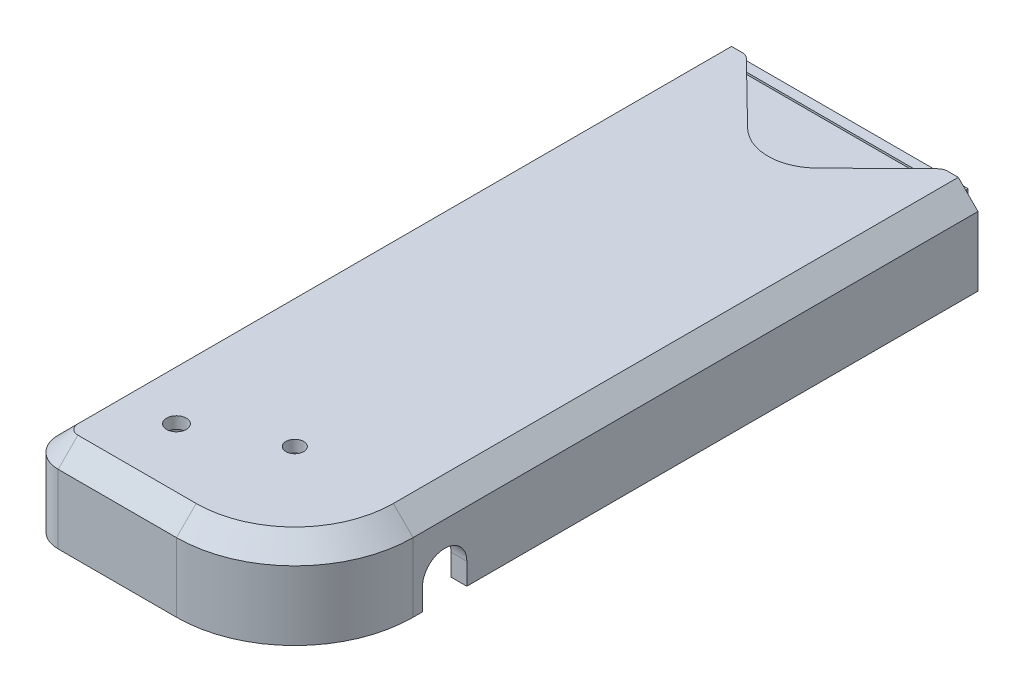
from build123d import *

# Parameters (mm, degrees)
EXTRUDE_1_DEPTH     = 9
SKETCH_2_W          = 12.1
SKETCH_2_H          = 5
CUT_EXTRUDE_1_DEPTH = 0.9
SKETCH_3_R          = 29.401854515
SKETCH_3_W          = 23
SKETCH_3_H          = 15
CUT_EXTRUDE_2_DEPTH = 1
CHAMFER_1_SIZE      = 2
CUT_EXTRUDE_4_DEPTH = 7.8
SKETCH_5_W          = 12.1
SKETCH_5_H          = 1.6
CUT_EXTRUDE_5_DEPTH = 5
SKETCH_6_R          = 1
SKETCH_6_R_2        = 0.9
CUT_EXTRUDE_6_DEPTH = 3
CUT_EXTRUDE_7_DEPTH = 3
EXTRUDE_2_DEPTH     = 3
CUT_EXTRUDE_9_DEPTH = 1.7
FILLET_1_R          = 1


with BuildPart() as part:
    # Эскиз1 → Бобышка-Вытянуть1 (new body)
    with BuildSketch(Plane(origin=(0, 0, 0), x_dir=(1, 0, 0), z_dir=(0, 1, 0))):
        with BuildLine():
            Line((-13.5, 35.6), (13.5, 35.6))
            Line((13.5, 35.6), (13.5, -23.6))
            ThreePointArc((13.5, -23.6), (9.985281374, -32.085281374), (1.5, -35.6))
            Line((1.5, -35.6), (-10.5, -35.6))
            ThreePointArc((-10.5, -35.6), (-12.621320344, -34.721320344), (-13.5, -32.6))
            Line((-13.5, -32.6), (-13.5, 35.6))
        make_face()
    extrude(amount=EXTRUDE_1_DEPTH)

    # Эскиз2 → Вырез-Вытянуть1 (cut)
    with BuildSketch(Plane(origin=(0, 0, -35.6), x_dir=(-1, 0, 0), z_dir=(0, 0, -1))):
        Polygon((7.05, 6), (7.05, 0), (13.5, 0), (13.5, 9), (-13.5, 9), (-13.5, 0), (-7.05, 0), (-7.05, 6), align=None)
        with Locations((0, 2.5)):
            Rectangle(SKETCH_2_W, SKETCH_2_H)
    extrude(amount=-CUT_EXTRUDE_1_DEPTH, mode=Mode.SUBTRACT)

    # Эскиз3 → Вырез-Вытянуть2 (cut)
    with BuildSketch(Plane(origin=(0, 0, -34.7), x_dir=(-1, 0, 0), z_dir=(0, 0, -1))):
        Circle(SKETCH_3_R)
        Rectangle(SKETCH_3_W, SKETCH_3_H, mode=Mode.SUBTRACT)
    extrude(amount=-CUT_EXTRUDE_2_DEPTH, mode=Mode.SUBTRACT)

    # Фаска1
    chamfer_1_edges = [part.edges().sort_by_distance(p)[0] for p in [
        (-4.5, 9, 35.6),
        (9.985281374, 9, 32.085281374),
        (13.5, 9, -5.05),
        (-13.5, 9, -0.55),
        (-12.621320344, 9, 34.721320344),
    ]]
    chamfer(chamfer_1_edges, length=CHAMFER_1_SIZE)

    # Эскиз4 → Вырез-Вытянуть4 (cut)
    with BuildSketch(Plane.XZ):
        with BuildLine():
            Line((9.9, -33.1), (9.9, -32.1))
            Line((9.9, -32.1), (11.9, -32.1))
            Line((11.9, -32.1), (11.9, 23.6))
            ThreePointArc((11.9, 23.6), (8.853910524, 30.953910524), (1.5, 34))
            Line((1.5, 34), (-10.5, 34))
            ThreePointArc((-10.5, 34), (-11.489949494, 33.589949494), (-11.9, 32.6))
            Line((-11.9, 32.6), (-11.9, -32.1))
            Line((-11.9, -32.1), (-9.9, -32.1))
            Line((-9.9, -32.1), (-9.9, -33.1))
            Line((-9.9, -33.1), (9.9, -33.1))
        make_face()
    extrude(amount=-CUT_EXTRUDE_4_DEPTH, mode=Mode.SUBTRACT)

    # Эскиз5 → Вырез-Вытянуть5 (cut)
    with BuildSketch(Plane.XZ):
        with Locations((0, -33.9)):
            Rectangle(SKETCH_5_W, SKETCH_5_H)
    extrude(amount=-CUT_EXTRUDE_5_DEPTH, mode=Mode.SUBTRACT)

    # Эскиз6 → Вырез-Вытянуть6 (cut)
    with BuildSketch(Plane(origin=(0, 9, 0), x_dir=(1, 0, 0), z_dir=(0, 1, 0))):
        with Locations(Location((-6.5, -27.6, 0), (0, 0, 270))):
            Circle(SKETCH_6_R)
        with Locations(Location((1.5, -23.6, 0), (0, 0, 270))):
            Circle(SKETCH_6_R_2)
    extrude(amount=-CUT_EXTRUDE_6_DEPTH, mode=Mode.SUBTRACT)

    # Эскиз8 → Вырез-Вытянуть7 (cut)
    with BuildSketch(Plane(origin=(13.5, 0, 0), x_dir=(0, 0, -1), z_dir=(1, 0, 0))):
        with BuildLine():
            Line((-22.65, 2.2), (-22.65, 0))
            Line((-22.65, 0), (-18.15, 0))
            Line((-18.15, 0), (-18.15, 2.2))
            ThreePointArc((-18.15, 2.2), (-20.4, 4.45), (-22.65, 2.2))
        make_face()
    extrude(amount=-CUT_EXTRUDE_7_DEPTH, mode=Mode.SUBTRACT)

    # Эскиз10 → Бобышка-Вытянуть2 (add)
    with BuildSketch(Plane(origin=(0, 9, 0), x_dir=(1, 0, 0), z_dir=(0, 1, 0))):
        with BuildLine():
            Line((-11.5, 33.7), (11.5, 33.7))
            Line((11.5, 33.7), (4.619956712, 26.186537456))
            ThreePointArc((4.619956712, 26.186537456), (0, 24.3), (-4.619956712, 26.186537456))
            Line((-4.619956712, 26.186537456), (-11.5, 33.7))
        make_face()
    extrude(amount=-EXTRUDE_2_DEPTH)

    # Эскиз9 → Вырез-Вытянуть9 (cut)
    with BuildSketch(Plane(origin=(0, 9, 0), x_dir=(1, 0, 0), z_dir=(0, 1, 0))):
        with BuildLine():
            Line((-10, 33.7), (-3.5, 27.329208434))
            ThreePointArc((-3.5, 27.329208434), (0, 25.9), (3.5, 27.329208434))
            Line((3.5, 27.329208434), (10, 33.7))
            Line((10, 33.7), (-10, 33.7))
        make_face()
    extrude(amount=-CUT_EXTRUDE_9_DEPTH, mode=Mode.SUBTRACT)

    # Скругление1
    fillet_1_edges = [part.edges().sort_by_distance(p)[0] for p in [
        (-10, 8.25, -33.7),
        (10, 8.25, -33.7),
    ]]
    fillet(fillet_1_edges, radius=FILLET_1_R)


solid = part.part
